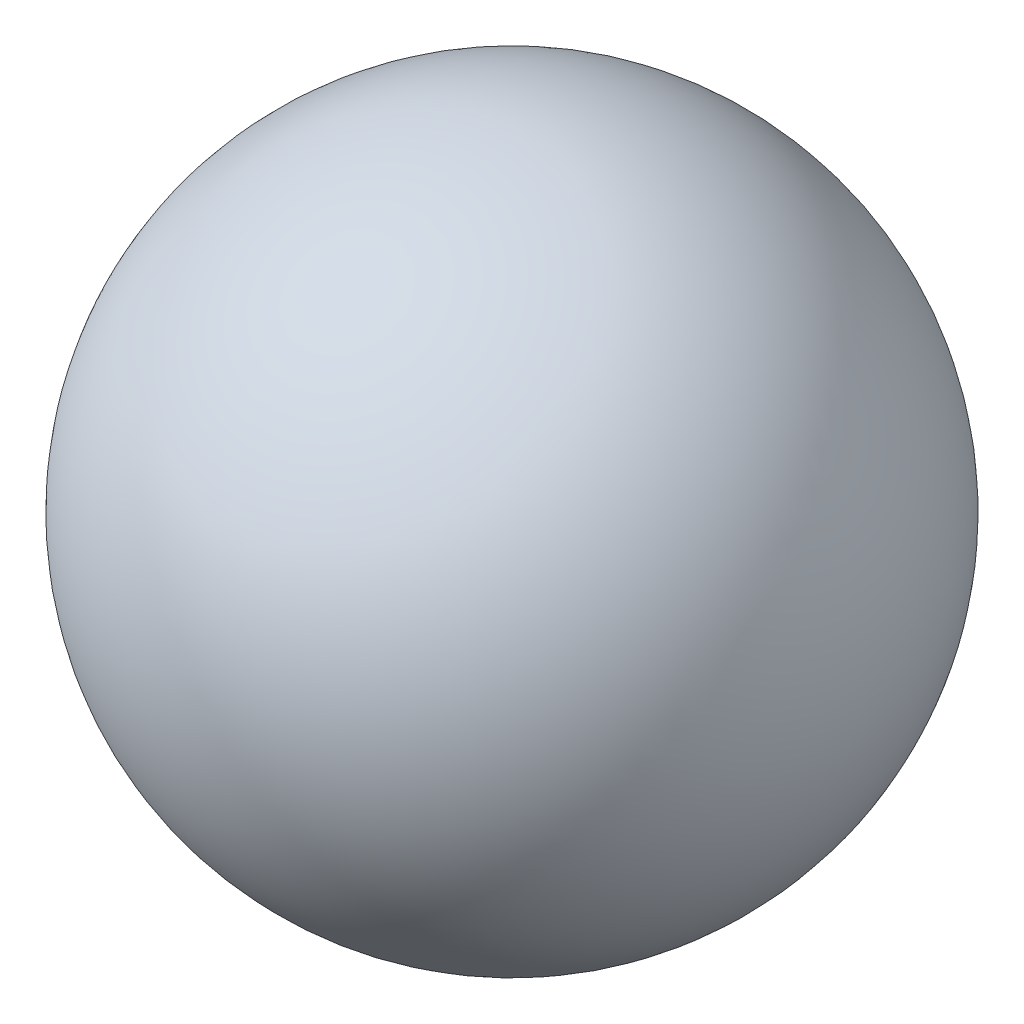
from build123d import *

# Parameters (mm, degrees)
SPRING_SLOT_PROFILE_R = 0.5
SPRING_SLOT_CUT_DEPTH = 10


with BuildPart() as part:
    # Sphere Profile → Sphere Revolve (revolve)
    with BuildSketch(Plane.XY):
        with BuildLine():
            Line((0, 1.35), (0, -1.35))
            ThreePointArc((0, -1.35), (-1.35, 0), (0, 1.35))
        make_face()
    revolve(axis=Axis((0, 1.35, 0), (0, -1, 0)))

    # Spring Slot Profile → Spring Slot Cut (cut)
    with BuildSketch(Plane(origin=(0, 0, 0), x_dir=(0, 0, -1), z_dir=(1, 0, 0))):
        Circle(SPRING_SLOT_PROFILE_R)
    extrude(amount=-SPRING_SLOT_CUT_DEPTH, mode=Mode.SUBTRACT)


solid = part.part
